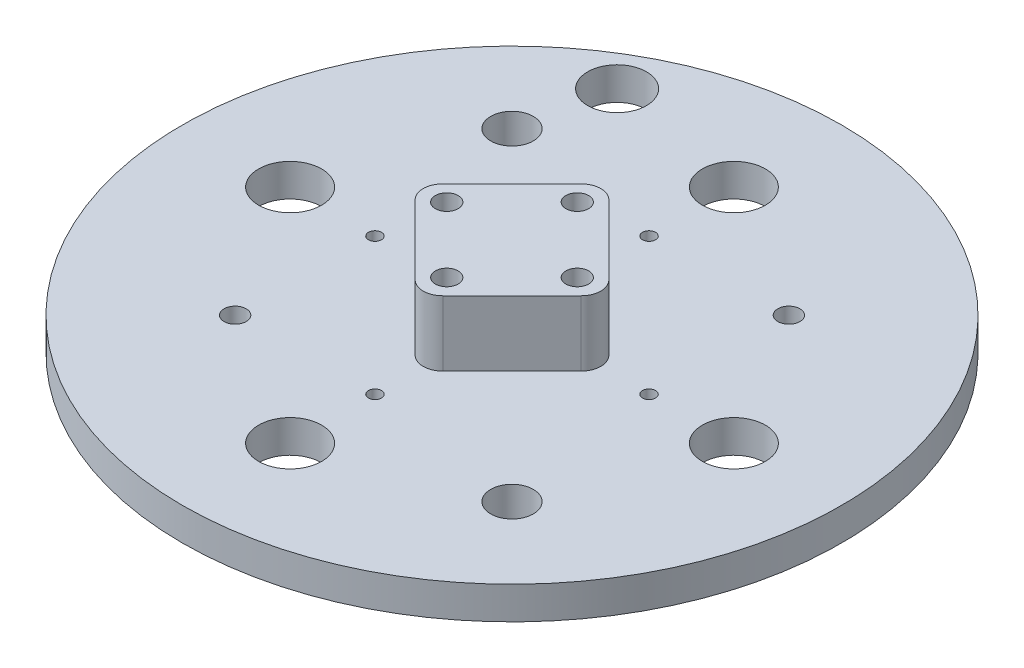
from build123d import *

# Parameters (mm, degrees)
SKETCH1_R           = 50.5
BOSS_EXTRUDE1_DEPTH = 5
SKETCH3_R           = 1.75
BOSS_EXTRUDE2_DEPTH = 10
SKETCH4_R           = 1.7
SKETCH4_R_2         = 3.2639
CUT_EXTRUDE2_DEPTH  = 73.114492302
SKETCH5_R           = 4.826
CUT_EXTRUDE3_DEPTH  = 73.114492302
SKETCH6_R           = 1
CUT_EXTRUDE4_DEPTH  = 10
FILLET1_R           = 3
SKETCH7_R           = 4.5
CUT_EXTRUDE5_DEPTH  = 73.97602346


with BuildPart() as part:
    # Sketch1 → Boss-Extrude1 (new body)
    with BuildSketch(Plane(origin=(0, 0, 0), x_dir=(1, 0, 0), z_dir=(0, 1, 0))):
        with Locations(Location((0, 0, 0), (0, 0, 270))):
            Circle(SKETCH1_R)
    extrude(amount=BOSS_EXTRUDE1_DEPTH)

    # Sketch3 → Boss-Extrude2 (add)
    with BuildSketch(Plane(origin=(0, 5, 0), x_dir=(1, 0, 0), z_dir=(0, 1, 0))):
        Polygon((0, -14.849242405), (14.849242405, 0), (0, 14.849242405), (-14.849242405, 0), align=None)
        with Locations(Location((10, 0, 0), (0, 0, 270))):
            Circle(SKETCH3_R, mode=Mode.SUBTRACT)
        with Locations(Location((0, -10, 0), (0, 0, 270))):
            Circle(SKETCH3_R, mode=Mode.SUBTRACT)
        with Locations(Location((-10, 0, 0), (0, 0, 270))):
            Circle(SKETCH3_R, mode=Mode.SUBTRACT)
        with Locations(Location((0, 10, 0), (0, 0, 270))):
            Circle(SKETCH3_R, mode=Mode.SUBTRACT)
    extrude(amount=BOSS_EXTRUDE2_DEPTH)

    # Sketch4 → Cut-Extrude2 (cut, through all)
    with BuildSketch(Plane(origin=(0, 5, 0), x_dir=(1, 0, 0), z_dir=(0, 1, 0))):
        with Locations(Location((21.213203436, 21.213203436, 0), (0, 0, 270))):
            Circle(SKETCH4_R)
        with Locations(Location((-21.213203436, -21.213203436, 0), (0, 0, 90))):
            Circle(SKETCH4_R)
        with Locations(Location((-24.748737342, 24.748737342, 0), (0, 0, 270))):
            Circle(SKETCH4_R_2)
        with Locations(Location((24.748737342, -24.748737342, 0), (0, 0, 90))):
            Circle(SKETCH4_R_2)
    extrude(amount=-CUT_EXTRUDE2_DEPTH, mode=Mode.SUBTRACT)

    # Sketch5 → Cut-Extrude3 (cut, through all)
    with BuildSketch(Plane(origin=(0, 5, 0), x_dir=(1, 0, 0), z_dir=(0, 1, 0))):
        with Locations(Location((34, 0, 0), (0, 0, 270))):
            Circle(SKETCH5_R)
        with Locations(Location((0, 34, 0), (0, 0, 270))):
            Circle(SKETCH5_R)
        with Locations(Location((-34, 0, 0), (0, 0, 270))):
            Circle(SKETCH5_R)
        with Locations(Location((0, -34, 0), (0, 0, 270))):
            Circle(SKETCH5_R)
    extrude(amount=-CUT_EXTRUDE3_DEPTH, mode=Mode.SUBTRACT)

    # Sketch6 → Cut-Extrude4 (cut)
    with BuildSketch(Plane(origin=(0, 5, 0), x_dir=(1, 0, 0), z_dir=(0, 1, 0))):
        with Locations(Location((0, 21, 0), (0, 0, 270))):
            Circle(SKETCH6_R)
        with Locations(Location((-21, 0, 0), (0, 0, 270))):
            Circle(SKETCH6_R)
        with Locations(Location((21, 0, 0), (0, 0, 270))):
            Circle(SKETCH6_R)
        with Locations(Location((0, -21, 0), (0, 0, 270))):
            Circle(SKETCH6_R)
    extrude(amount=-CUT_EXTRUDE4_DEPTH, mode=Mode.SUBTRACT)

    # Fillet1
    fillet1_edges = [part.edges().sort_by_distance(p)[0] for p in [
        (-14.849242405, 10, 0),
        (0, 10, 14.849242405),
        (14.849242405, 10, 0),
        (0, 10, -14.849242405),
    ]]
    fillet(fillet1_edges, radius=FILLET1_R)

    # Sketch7 → Cut-Extrude5 (cut, through all)
    with BuildSketch(Plane(origin=(0, 0, 0), x_dir=(1, 0, 0), z_dir=(0, 1, 0))):
        with Locations(Location((-22, 38.105117767, 0), (0, 0, 270))):
            Circle(SKETCH7_R)
    extrude(amount=CUT_EXTRUDE5_DEPTH, mode=Mode.SUBTRACT)


solid = part.part
